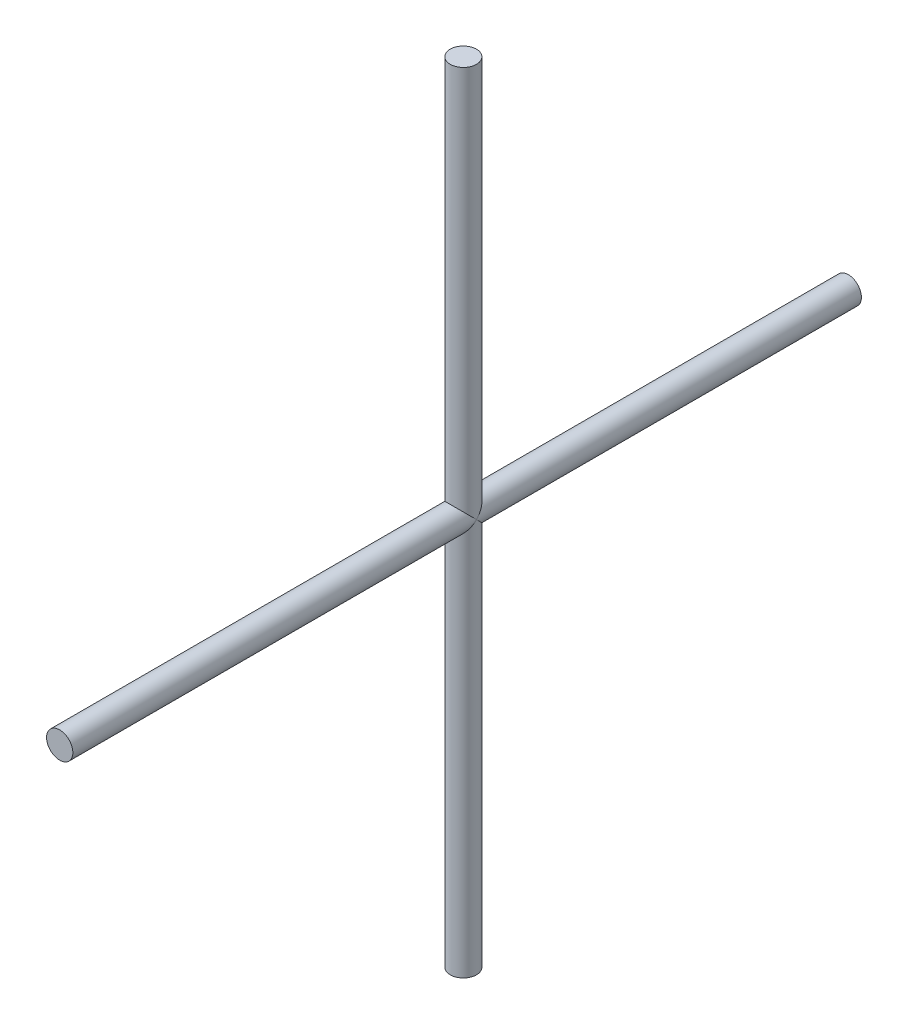
from build123d import *

# Parameters (mm, degrees)
SKETCH1_R           = 5
BOSS_EXTRUDE1_DEPTH = 300
SKETCH2_R           = 5
BOSS_EXTRUDE2_DEPTH = 150


with BuildPart() as part:
    # Sketch1 → Boss-Extrude1 (new body)
    with BuildSketch(Plane.XY):
        Circle(SKETCH1_R)
    extrude(amount=BOSS_EXTRUDE1_DEPTH)

    # Sketch2 → Boss-Extrude2 (add, symmetric)
    with BuildSketch(Plane(origin=(0, 0, 0), x_dir=(1, 0, 0), z_dir=(0, 1, 0))):
        with Locations((0, -146.435568709)):
            Circle(SKETCH2_R)
    extrude(amount=BOSS_EXTRUDE2_DEPTH, both=True)


solid = part.part
